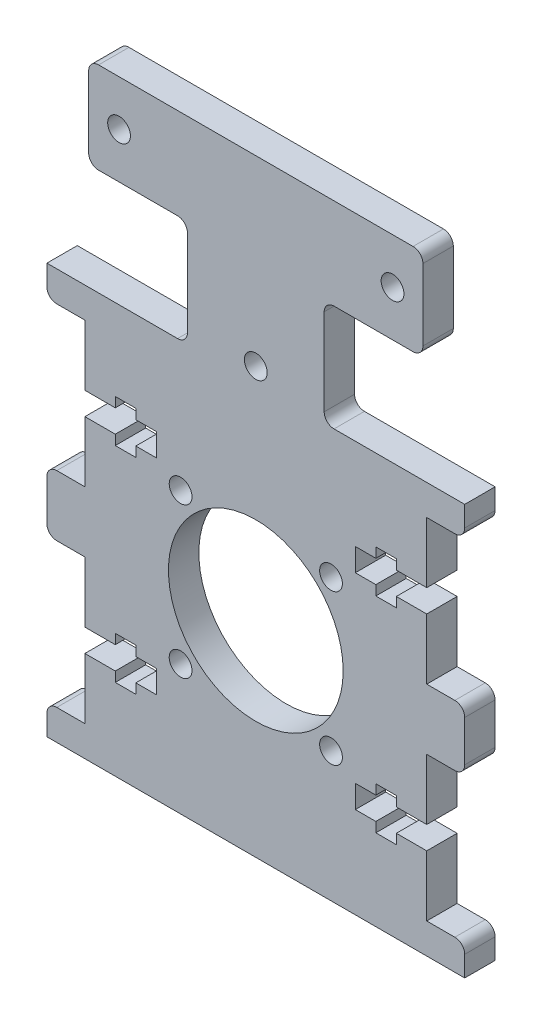
from build123d import *

# Parameters (mm, degrees)
SKETCH_1_R      = 1.5
SKETCH_1_R_2    = 11.5
EXTRUDE_1_DEPTH = 4
FILLET_1_R      = 1.3


with BuildPart() as part:
    # 草图1 → 凸台-拉伸1 (new body)
    with BuildSketch(Plane.XY):
        Polygon((22.5, -27), (-22.5, -27), (-27.5, -27), (-27.5, -23), (-22.5, -23), (-22.5, -15), (-18.5, -15), (-18.5, -16.3), (-15.8, -16.3), (-15.8, -15), (-13.1, -15), (-13.1, -12), (-15.8, -12), (-15.8, -10.7), (-18.5, -10.7), (-18.5, -12), (-22.5, -12), (-22.5, -4), (-27.5, -4), (-27.5, 4), (-22.5, 4), (-22.5, 12), (-18.5, 12), (-18.5, 10.7), (-15.8, 10.7), (-15.8, 12), (-13.1, 12), (-13.1, 15), (-15.8, 15), (-15.8, 16.3), (-18.5, 16.3), (-18.5, 15), (-22.5, 15), (-22.5, 23), (-27.5, 23), (-27.5, 27), (-22.5, 27), (-9, 27), (-9, 41), (-22, 41), (-22, 53), (22, 53), (22, 41), (9, 41), (9, 27), (22.5, 27), (27.5, 27), (27.5, 23), (22.5, 23), (22.5, 15), (18.5, 15), (18.5, 16.3), (15.8, 16.3), (15.8, 15), (13.1, 15), (13.1, 12), (15.8, 12), (15.8, 10.7), (18.5, 10.7), (18.5, 12), (22.5, 12), (22.5, 4), (27.5, 4), (27.5, -4), (22.5, -4), (22.5, -12), (18.5, -12), (18.5, -10.7), (15.8, -10.7), (15.8, -12), (13.1, -12), (13.1, -15), (15.8, -15), (15.8, -16.3), (18.5, -16.3), (18.5, -15), (22.5, -15), (22.5, -23), (27.5, -23), (27.5, -27), align=None)
        with Locations((9.899494937, 9.899494937)):
            Circle(SKETCH_1_R, mode=Mode.SUBTRACT)
        Circle(SKETCH_1_R_2, mode=Mode.SUBTRACT)
        with Locations((9.899494937, -9.899494937)):
            Circle(SKETCH_1_R, mode=Mode.SUBTRACT)
        with Locations((-9.899494937, -9.899494937)):
            Circle(SKETCH_1_R, mode=Mode.SUBTRACT)
        with Locations((-9.899494937, 9.899494937)):
            Circle(SKETCH_1_R, mode=Mode.SUBTRACT)
        with Locations((-18, 47)):
            Circle(SKETCH_1_R, mode=Mode.SUBTRACT)
        with Locations((18, 47)):
            Circle(SKETCH_1_R, mode=Mode.SUBTRACT)
        with Locations((0, 29)):
            Circle(SKETCH_1_R, mode=Mode.SUBTRACT)
    extrude(amount=EXTRUDE_1_DEPTH)

    # 圆角1
    fillet_1_edges = [part.edges().sort_by_distance(p)[0] for p in [
        (-9, 27, 2),
        (-9, 41, 2),
        (-22, 41, 2),
        (-22, 53, 2),
        (22, 53, 2),
        (22, 41, 2),
        (9, 41, 2),
        (9, 27, 2),
        (27.5, 23, 2),
        (27.5, 4, 2),
        (27.5, -4, 2),
        (27.5, -23, 2),
        (-27.5, -23, 2),
        (-27.5, -4, 2),
        (-27.5, 4, 2),
        (-27.5, 23, 2),
    ]]
    fillet(fillet_1_edges, radius=FILLET_1_R)


solid = part.part
